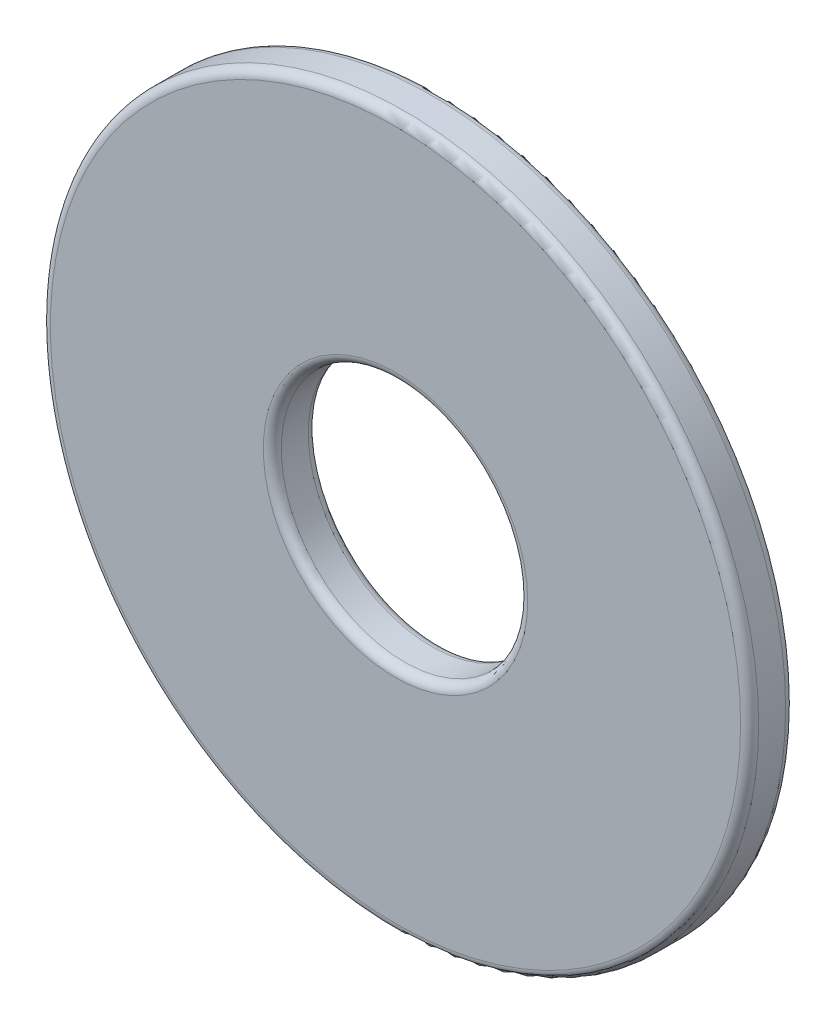
from build123d import *

# Parameters (mm, degrees)
BOSS_EXTRUDE1_START = 0.80645
SKETCH3_R           = 12.7
SKETCH3_R_2         = 4.4196
BOSS_EXTRUDE1_DEPTH = 1.6129
FILLET1_R           = 0.32258


with BuildPart() as part:
    # Sketch3 → Boss-Extrude1 (new body)
    with BuildSketch(Plane.XY.offset(BOSS_EXTRUDE1_START)):
        Circle(SKETCH3_R)
        Circle(SKETCH3_R_2, mode=Mode.SUBTRACT)
    extrude(amount=-BOSS_EXTRUDE1_DEPTH)

    # Fillet1
    fillet1_edges = [part.edges().sort_by_distance(p)[0] for p in [
        (-12.7, 0, 0.80645),
        (-12.7, 0, -0.80645),
        (-4.4196, 0, -0.80645),
        (-4.4196, 0, 0.80645),
    ]]
    fillet(fillet1_edges, radius=FILLET1_R)


solid = part.part
